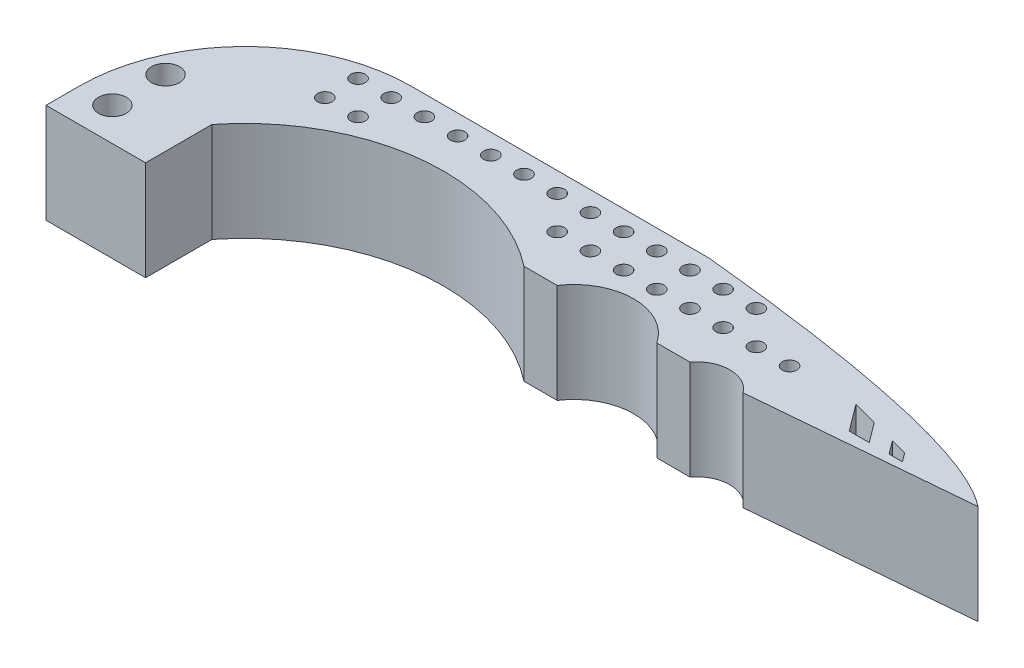
from build123d import *

# Parameters (mm, degrees)
SKETCH_1_W          = 15
SKETCH_1_H          = 30
EXTRUDE_1_DEPTH     = 15
SKETCH_2_R          = 1.1
SKETCH_2_R_2        = 2.1
CUT_EXTRUDE_1_DEPTH = 15
FILLET_2_R          = 25
CUT_EXTRUDE_2_REACH = 117


with BuildPart() as part:
    # 草图1 → 凸台-拉伸1 (new body)
    with BuildSketch(Plane(origin=(0, 0, 0), x_dir=(1, 0, 0), z_dir=(0, 1, 0))):
        with BuildLine():
            Line((55, 0), (0, 0))
            Line((0, 0), (0, -20))
            ThreePointArc((0, -20), (19.968938053, -8.839079645), (42, -15))
            Line((42, -15), (47, -15))
            ThreePointArc((47, -15), (54.5, -10.974937186), (62, -15))
            Line((62, -15), (67, -15))
            ThreePointArc((67, -15), (71, -13), (75, -15))
            Line((75, -15), (110, -15))
            add(Edge.make_bspline(
                [(55, 0), (105, -5), (110, -15)],
                knots=[0, 0, 0, 1, 1, 1], degree=2))
        make_face()
        with Locations((-7.5, -15)):
            Rectangle(SKETCH_1_W, SKETCH_1_H)
    extrude(amount=EXTRUDE_1_DEPTH)

    # 草图2 → 切除-拉伸1 (cut)
    with BuildSketch(Plane(origin=(0, 15, 0), x_dir=(1, 0, 0), z_dir=(0, 1, 0))):
        with Locations(Location((5, -3, 0), (0, 0, 270))):
            Circle(SKETCH_2_R)
        with Locations(Location((10, -3, 0), (0, 0, 270))):
            Circle(SKETCH_2_R)
        with Locations(Location((15, -3, 0), (0, 0, 270))):
            Circle(SKETCH_2_R)
        with Locations(Location((20, -3, 0), (0, 0, 270))):
            Circle(SKETCH_2_R)
        with Locations(Location((25, -3, 0), (0, 0, 270))):
            Circle(SKETCH_2_R)
        with Locations(Location((30, -3, 0), (0, 0, 270))):
            Circle(SKETCH_2_R)
        with Locations(Location((35, -3, 0), (0, 0, 270))):
            Circle(SKETCH_2_R)
        with Locations(Location((40, -3, 0), (0, 0, 270))):
            Circle(SKETCH_2_R)
        with Locations(Location((45, -3, 0), (0, 0, 270))):
            Circle(SKETCH_2_R)
        with Locations(Location((50, -3, 0), (0, 0, 270))):
            Circle(SKETCH_2_R)
        with Locations(Location((55, -3, 0), (0, 0, 270))):
            Circle(SKETCH_2_R)
        with Locations(Location((60, -3, 0), (0, 0, 270))):
            Circle(SKETCH_2_R)
        with Locations(Location((5, -8, 0), (0, 0, 270))):
            Circle(SKETCH_2_R)
        with Locations(Location((10, -8, 0), (0, 0, 270))):
            Circle(SKETCH_2_R)
        with Locations(Location((45, -8, 0), (0, 0, 270))):
            Circle(SKETCH_2_R)
        with Locations(Location((50, -8, 0), (0, 0, 270))):
            Circle(SKETCH_2_R)
        with Locations(Location((55, -8, 0), (0, 0, 270))):
            Circle(SKETCH_2_R)
        with Locations(Location((60, -8, 0), (0, 0, 270))):
            Circle(SKETCH_2_R)
        with Locations(Location((65, -3, 0), (0, 0, 270))):
            Circle(SKETCH_2_R)
        with Locations(Location((65, -8, 0), (0, 0, 270))):
            Circle(SKETCH_2_R)
        with Locations(Location((70, -8, 0), (0, 0, 270))):
            Circle(SKETCH_2_R)
        with Locations(Location((75, -8, 0), (0, 0, 270))):
            Circle(SKETCH_2_R)
        with Locations(Location((-10, -25, 0), (0, 0, 270))):
            Circle(SKETCH_2_R_2)
        with Locations(Location((-10, -17, 0), (0, 0, 270))):
            Circle(SKETCH_2_R_2)
        with Locations(Location((40, -8, 0), (0, 0, 270))):
            Circle(SKETCH_2_R)
        Polygon((88, -12), (85, -8), (88.75, -9), (91, -12), align=None)
        Polygon((94, -12), (92.5, -10), (95, -10.666666667), (96, -12), align=None)
    extrude(amount=-CUT_EXTRUDE_1_DEPTH, mode=Mode.SUBTRACT)

    # 圆角2
    fillet_2_edges = [part.edges().sort_by_distance(p)[0] for p in [
        (-15, 7.5, 0),
    ]]
    fillet(fillet_2_edges, radius=FILLET_2_R)

    # 草图4 → 切除-拉伸2 (cut, up to next)
    with BuildSketch(Plane(origin=(0, 15, 0), x_dir=(1, 0, 0), z_dir=(0, 1, 0)), mode=Mode.PRIVATE) as cut_extrude_2_sk1:
        Polygon((75, -15), (107.538963766, -12.153209548), (110, -12.153209548), (110, -15), align=None)
    cut_extrude_2_tool1 = extrude(cut_extrude_2_sk1.sketch, amount=-CUT_EXTRUDE_2_REACH, mode=Mode.PRIVATE) & part.part
    add(cut_extrude_2_tool1.solids().sort_by_distance((98.27944, 15, 13.988729))[0], mode=Mode.SUBTRACT)


solid = part.part
